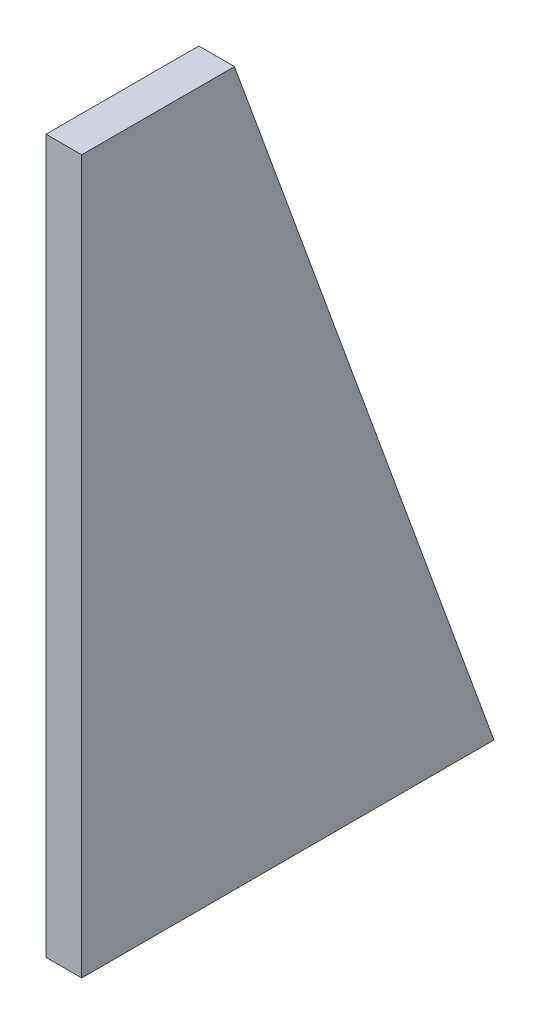
from build123d import *

# Parameters (mm, degrees)
SKETCH1_W           = 100
SKETCH1_H           = 100
BOSS_EXTRUDE1_DEPTH = 10
CUT_EXTRUDE2_DEPTH  = 5
CUT_EXTRUDE4_DEPTH  = 10
CUT_EXTRUDE5_DEPTH  = 5
SKETCH8_W           = 3
SKETCH8_H           = 3
CUT_EXTRUDE6_DEPTH  = 5


with BuildPart() as part:
    # Sketch1 → Boss-Extrude1 (new body)
    with BuildSketch(Plane(origin=(0, 0, 0), x_dir=(0, 0, -1), z_dir=(1, 0, 0))):
        Rectangle(SKETCH1_W, SKETCH1_H)
    extrude(amount=BOSS_EXTRUDE1_DEPTH)

    # Sketch2 → Cut-Extrude2 (cut)
    with BuildSketch(Plane.ZY):
        Polygon((36.397023427, 50), (33.897023427, 50), (-0.680148829, -45), (4.319851171, -45), (38.897023427, 50), align=None)
    extrude(amount=-CUT_EXTRUDE2_DEPTH, mode=Mode.SUBTRACT)

    # Sketch5 → Cut-Extrude4 (cut)
    with BuildSketch(Plane.ZY):
        Polygon((28.576134564, 50), (-50, 50), (-50, -50), (-7.820888862, -50), (-6.001037691, -45), (26.756283393, 45), align=None)
    extrude(amount=-CUT_EXTRUDE4_DEPTH, mode=Mode.SUBTRACT)

    # Sketch7 → Cut-Extrude5 (cut)
    with BuildSketch(Plane.ZY):
        Polygon((28.576134564, 50), (50, 50), (50, -50), (-7.820888862, -50), align=None)
    extrude(amount=-CUT_EXTRUDE5_DEPTH, mode=Mode.SUBTRACT)

    # Sketch8 → Cut-Extrude6 (cut)
    with BuildSketch(Plane.XZ.offset(50)):
        with Locations((7.5, 47.5)):
            Rectangle(SKETCH8_W, SKETCH8_H)
        with Locations((7.5, 2.5)):
            Rectangle(SKETCH8_W, SKETCH8_H)
    extrude(amount=-CUT_EXTRUDE6_DEPTH, mode=Mode.SUBTRACT)


solid = part.part
